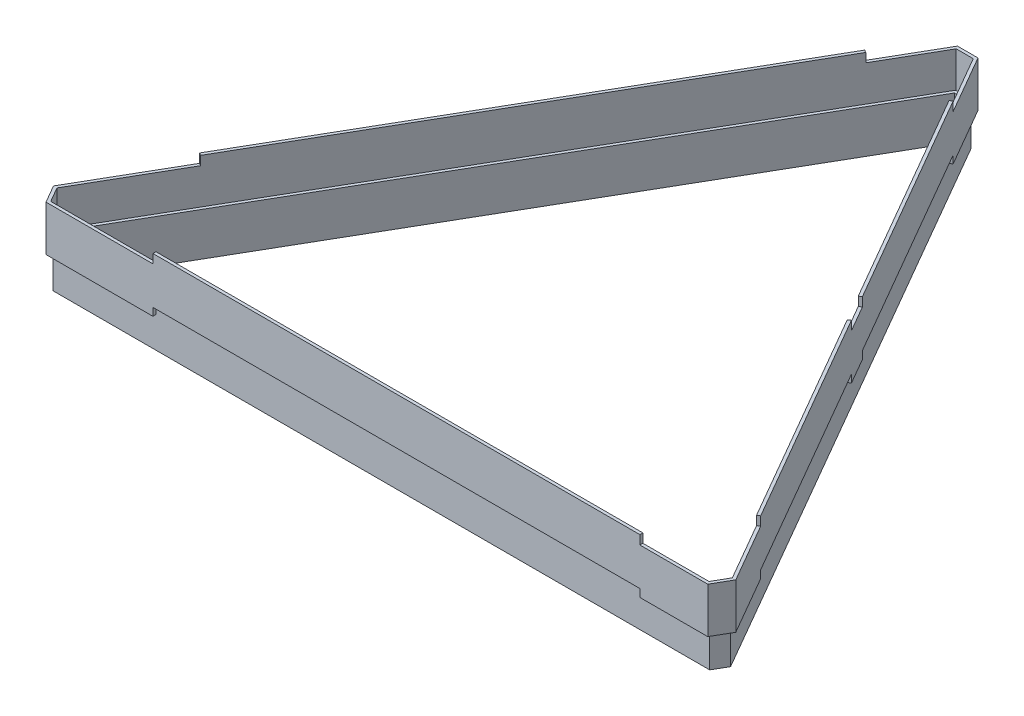
from build123d import *

# Parameters (mm, degrees)
BOSS_EXTRUDE1_DEPTH = 0.2
BOSS_EXTRUDE2_DEPTH = 12.58
SKETCH1_8_W         = 162.49
SKETCH1_8_H         = 1
BOSS_EXTRUDE3_DEPTH = 15.58
BOSS_EXTRUDE4_DEPTH = 13.38
BOSS_EXTRUDE5_DEPTH = 2.58
BOSS_EXTRUDE6_DEPTH = 1


with BuildPart() as part:
    # Sketch1 → Boss-Extrude1 (new body)
    with BuildSketch(Plane(origin=(0, 0, 0), x_dir=(1, 0, 0), z_dir=(0, 1, 0))):
        Polygon((-113.845299462, 0), (-110.422649731, -5.92820323), (110.422649731, -5.92820323), (113.845299462, 0), (3.422649731, 191.25763964), (-3.422649731, 191.25763964), align=None)
        Polygon((-1.979274058, 188.75763964), (1.979274058, 188.75763964), (110.958548116, 0), (108.979274058, -3.42820323), (-108.979274058, -3.42820323), (-110.958548116, 0), align=None, mode=Mode.SUBTRACT)
    extrude(amount=BOSS_EXTRUDE1_DEPTH)

    # Sketch1<7> → Boss-Extrude2 (add)
    with BuildSketch(Plane(origin=(0, 0, 0), x_dir=(1, 0, 0), z_dir=(0, 1, 0))):
        Polygon((-95.137949192, 30.402081141), (-96.003974596, 30.902081141), (-113.845299462, 0), (-110.422649731, -5.92820323), (-74.74, -5.92820323), (-74.74, -4.92820323), (-109.845299462, -4.92820323), (-112.690598923, 0), align=None)
        Polygon((-3.422649731, 191.25763964), (-14.758974596, 171.622549002), (-13.892949192, 171.122549002), (-2.845299462, 190.25763964), (2.845299462, 190.25763964), (13.892949192, 171.122549002), (14.758974596, 171.622549002), (3.422649731, 191.25763964), align=None)
        Polygon((109.845299462, -4.92820323), (87.75, -4.92820323), (87.75, -5.92820323), (110.422649731, -5.92820323), (113.845299462, 0), (102.508974596, 19.635090638), (101.642949192, 19.135090638), (112.690598923, 0), align=None)
        Polygon((61.133974596, 91.298692801), (56.133974596, 99.958946839), (55.267949192, 99.458946839), (60.267949192, 90.798692801), align=None)
    extrude(amount=BOSS_EXTRUDE2_DEPTH)

    # Sketch1<8> → Boss-Extrude3 (add)
    with BuildSketch(Plane(origin=(0, 0, 0), x_dir=(1, 0, 0), z_dir=(0, 1, 0))):
        Polygon((-14.758974596, 171.622549002), (-96.003974596, 30.902081141), (-95.137949192, 30.402081141), (-13.892949192, 171.122549002), align=None)
        with Locations((6.505, -5.42820323)):
            Rectangle(SKETCH1_8_W, SKETCH1_8_H)
        Polygon((56.133974596, 99.958946839), (14.758974596, 171.622549002), (13.892949192, 171.122549002), (55.267949192, 99.458946839), align=None)
        Polygon((102.508974596, 19.635090638), (61.133974596, 91.298692801), (60.267949192, 90.798692801), (101.642949192, 19.135090638), align=None)
    extrude(amount=BOSS_EXTRUDE3_DEPTH)

    # Sketch1<9> → Boss-Extrude4 (add)
    with BuildSketch(Plane(origin=(0, 0, 0), x_dir=(1, 0, 0), z_dir=(0, 1, 0))):
        Polygon((-112.113248654, 0), (-110.834936491, -2.214101615), (-109.556624327, -4.42820323), (109.556624327, -4.42820323), (112.113248654, 0), (2.556624327, 189.75763964), (-2.556624327, 189.75763964), align=None)
        Polygon((-110.958548116, 0), (-56.468911087, 94.37881982), (-1.979274058, 188.75763964), (1.979274058, 188.75763964), (110.958548116, 0), (108.979274058, -3.42820323), (-108.979274058, -3.42820323), align=None, mode=Mode.SUBTRACT)
    extrude(amount=-BOSS_EXTRUDE4_DEPTH)

    # Sketch1<10> → Boss-Extrude5 (add)
    with BuildSketch(Plane(origin=(0, 0, 0), x_dir=(1, 0, 0), z_dir=(0, 1, 0))):
        Polygon((-95.137949192, 30.402081141), (-96.003974596, 30.902081141), (-113.845299462, 0), (-110.422649731, -5.92820323), (-74.74, -5.92820323), (-74.74, -4.92820323), (-109.845299462, -4.92820323), (-112.690598923, 0), align=None)
        Polygon((-3.422649731, 191.25763964), (-14.758974596, 171.622549002), (-13.892949192, 171.122549002), (-2.845299462, 190.25763964), (2.845299462, 190.25763964), (13.892949192, 171.122549002), (14.758974596, 171.622549002), (3.422649731, 191.25763964), align=None)
        Polygon((109.845299462, -4.92820323), (87.75, -4.92820323), (87.75, -5.92820323), (110.422649731, -5.92820323), (113.845299462, 0), (102.508974596, 19.635090638), (101.642949192, 19.135090638), (112.690598923, 0), align=None)
        Polygon((61.133974596, 91.298692801), (56.133974596, 99.958946839), (55.267949192, 99.458946839), (60.267949192, 90.798692801), align=None)
    extrude(amount=-BOSS_EXTRUDE5_DEPTH)

    # Sketch1<11> → Boss-Extrude6 (add)
    with BuildSketch(Plane(origin=(0, 0, 0), x_dir=(1, 0, 0), z_dir=(0, 1, 0))):
        Polygon((-112.113248654, 0), (-110.834936491, -2.214101615), (-109.556624327, -4.42820323), (109.556624327, -4.42820323), (112.113248654, 0), (2.556624327, 189.75763964), (-2.556624327, 189.75763964), align=None)
        Polygon((-110.958548116, 0), (-56.468911087, 94.37881982), (-1.979274058, 188.75763964), (1.979274058, 188.75763964), (110.958548116, 0), (108.979274058, -3.42820323), (-108.979274058, -3.42820323), align=None, mode=Mode.SUBTRACT)
    extrude(amount=BOSS_EXTRUDE6_DEPTH)


solid = part.part
